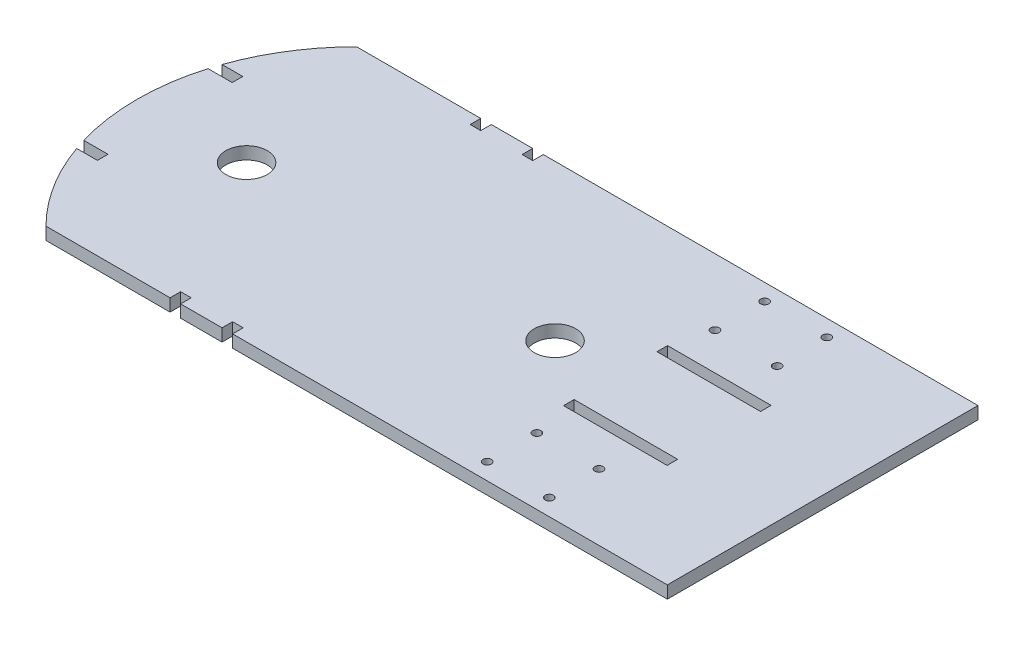
from build123d import *

# Parameters (mm, degrees)
SKETCH1_R           = 2
SKETCH1_R_2         = 10
BOSS_EXTRUDE1_DEPTH = 6
SKETCH2_W           = 50
SKETCH2_H           = 5.1
CUT_EXTRUDE1_DEPTH  = 299.24484337


with BuildPart() as part:
    # Sketch1 → Boss-Extrude1 (new body)
    with BuildSketch(Plane(origin=(0, 0, 0), x_dir=(1, 0, 0), z_dir=(0, 1, 0))):
        with BuildLine():
            Line((42.467703605, -75), (-167.432296395, -75))
            Line((-167.432296395, -75), (-167.432296395, -69.9))
            Line((-167.432296395, -69.9), (-172.532296395, -69.9))
            Line((-172.532296395, -69.9), (-172.532296395, -75))
            Line((-172.532296395, -75), (-192.532296395, -75))
            Line((-192.532296395, -75), (-192.532296395, -69.9))
            Line((-192.532296395, -69.9), (-197.632296395, -69.9))
            Line((-197.632296395, -69.9), (-197.632296395, -75))
            Line((-197.632296395, -75), (-257.532296395, -75))
            ThreePointArc((-257.532296395, -75), (-272.321614297, -56.461299938), (-282.622205976, -35.1))
            Line((-282.622205976, -35.1), (-272.622205976, -35.1))
            Line((-272.622205976, -35.1), (-272.622205976, -30))
            Line((-272.622205976, -30), (-284.267246142, -30))
            ThreePointArc((-284.267246142, -30), (-288.598313573, 0), (-284.267246142, 30))
            Line((-284.267246142, 30), (-272.622205976, 30))
            Line((-272.622205976, 30), (-272.622205976, 35.1))
            Line((-272.622205976, 35.1), (-282.622205976, 35.1))
            ThreePointArc((-282.622205976, 35.1), (-272.321614297, 56.461299938), (-257.532296395, 75))
            Line((-257.532296395, 75), (-197.632296395, 75))
            Line((-197.632296395, 75), (-197.632296395, 69.9))
            Line((-197.632296395, 69.9), (-192.532296395, 69.9))
            Line((-192.532296395, 69.9), (-192.532296395, 75))
            Line((-192.532296395, 75), (-172.532296395, 75))
            Line((-172.532296395, 75), (-172.532296395, 69.9))
            Line((-172.532296395, 69.9), (-167.432296395, 69.9))
            Line((-167.432296395, 69.9), (-167.432296395, 75))
            Line((-167.432296395, 75), (42.467703605, 75))
            Line((42.467703605, 75), (42.467703605, -75))
        make_face()
        with Locations(Location((-52.532296395, 67, 0), (0, 0, 270))):
            Circle(SKETCH1_R, mode=Mode.SUBTRACT)
        with Locations(Location((-22.532296395, 67, 0), (0, 0, 270))):
            Circle(SKETCH1_R, mode=Mode.SUBTRACT)
        with Locations(Location((-22.532296395, 43, 0), (0, 0, 270))):
            Circle(SKETCH1_R, mode=Mode.SUBTRACT)
        with Locations(Location((-52.532296395, 43, 0), (0, 0, 270))):
            Circle(SKETCH1_R, mode=Mode.SUBTRACT)
        with Locations(Location((-22.532296395, -67, 0), (0, 0, 90))):
            Circle(SKETCH1_R, mode=Mode.SUBTRACT)
        with Locations(Location((-22.532296395, -43, 0), (0, 0, 90))):
            Circle(SKETCH1_R, mode=Mode.SUBTRACT)
        with Locations(Location((-52.532296395, -43, 0), (0, 0, 90))):
            Circle(SKETCH1_R, mode=Mode.SUBTRACT)
        with Locations(Location((-52.532296395, -67, 0), (0, 0, 90))):
            Circle(SKETCH1_R, mode=Mode.SUBTRACT)
        with Locations(Location((-86.761151279, 0, 0), (0, 0, 270))):
            Circle(SKETCH1_R_2, mode=Mode.SUBTRACT)
        with Locations(Location((-235.692156702, 0, 0), (0, 0, 270))):
            Circle(SKETCH1_R_2, mode=Mode.SUBTRACT)
    extrude(amount=BOSS_EXTRUDE1_DEPTH)

    # Sketch2 → Cut-Extrude1 (cut, through all)
    with BuildSketch(Plane(origin=(0, 6, 0), x_dir=(1, 0, 0), z_dir=(0, 1, 0))):
        with Locations((-32.532296395, 22.55)):
            Rectangle(SKETCH2_W, SKETCH2_H)
        with Locations((-32.532296395, -22.55)):
            Rectangle(SKETCH2_W, SKETCH2_H)
    extrude(amount=-CUT_EXTRUDE1_DEPTH, mode=Mode.SUBTRACT)


solid = part.part
